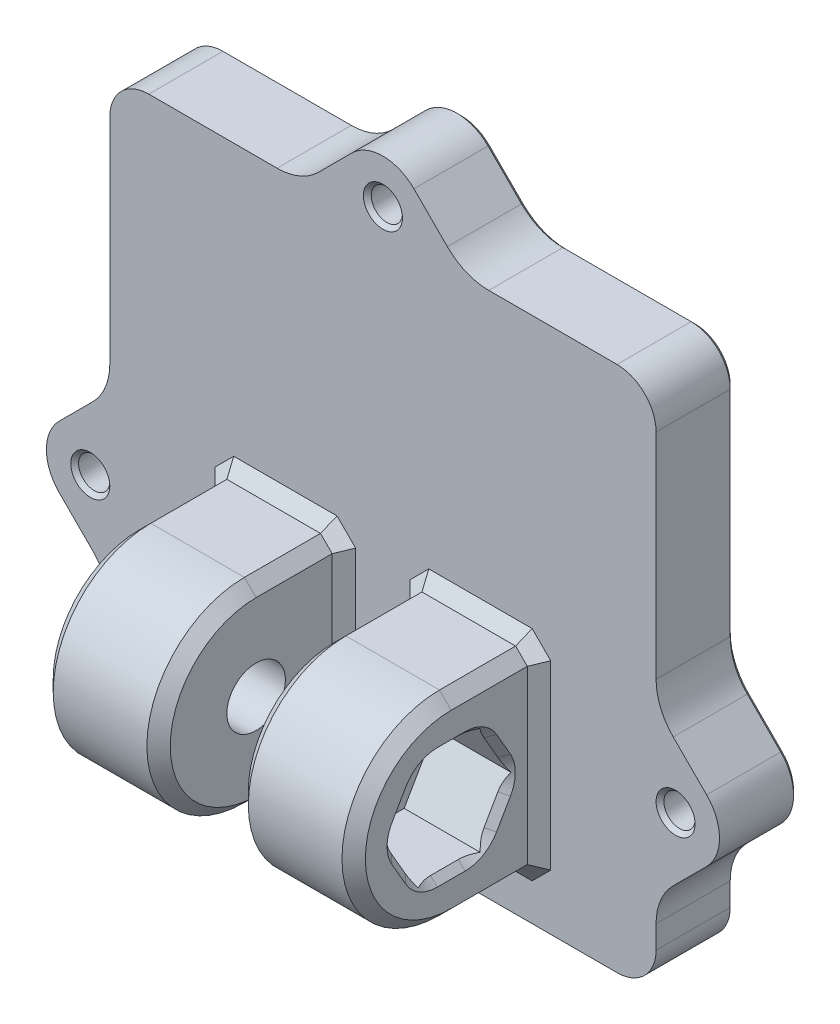
from build123d import *

# Parameters (mm, degrees)
SKETCH13_R          = 0.8
BOSS_EXTRUDE3_DEPTH = 4
BOSS_EXTRUDE4_START = -1
BOSS_EXTRUDE4_DEPTH = 1
SKETCH13_3_R        = 1.05
CUT_EXTRUDE10_DEPTH = 1
CHAMFER3_SIZE       = 0.6
CUT_EXTRUDE7_REACH  = 37.052
SKETCH15_W          = 22.3
SKETCH15_H          = 2.6
CUT_EXTRUDE8_DEPTH  = 0.4
CHAMFER4_SIZE       = 0.2
BOSS_EXTRUDE5_START = -14
BOSS_EXTRUDE5_DEPTH = 8
SKETCH18_W          = 4
SKETCH18_H          = 9.5
CUT_EXTRUDE11_DEPTH = 29.193527626
CUT_EXTRUDE13_START = -6
SKETCH17_3_R        = 2.75
SKETCH17_3_R_2      = 1.5
CUT_EXTRUDE13_DEPTH = 2.5
CUT_EXTRUDE14_START = -18
SKETCH17_4_R        = 2.75
SKETCH17_4_R_2      = 1.5
CUT_EXTRUDE14_DEPTH = 4
CUT_EXTRUDE16_START = -22
CUT_EXTRUDE16_DEPTH = 1
CUT_EXTRUDE16_TAPER = 45
CHAMFER5_SIZE       = 0.6
CHAMFER6_SIZE       = 0.6
SKETCH17_6_R        = 1.5
CUT_EXTRUDE17_DEPTH = 45.077346789
CHAMFER7_SIZE       = 0.4


with BuildPart() as part:
    # Sketch13 → Boss-Extrude3 (new body)
    with BuildSketch(Plane.XY):
        with BuildLine():
            Line((-5.424621202, -1), (-12, -1))
            ThreePointArc((-12, -1), (-13.414213562, -1.585786438), (-14, -3))
            Line((-14, -3), (-14, -13.975378798))
            ThreePointArc((-14, -13.975378798), (-14.228361402, -15.123429095), (-14.878679656, -16.096699141))
            Line((-14.878679656, -16.096699141), (-16.590990258, -17.809009742))
            ThreePointArc((-16.590990258, -17.809009742), (-17.25, -19.4), (-16.590990258, -20.990990258))
            Line((-16.590990258, -20.990990258), (-14.878679656, -22.703300859))
            ThreePointArc((-14.878679656, -22.703300859), (-14.228361402, -23.676570905), (-14, -24.824621202))
            Line((-14, -24.824621202), (-14, -26))
            ThreePointArc((-14, -26), (-13.414213562, -27.414213562), (-12, -28))
            Line((-12, -28), (12, -28))
            ThreePointArc((12, -28), (13.414213562, -27.414213562), (14, -26))
            Line((14, -26), (14, -24.824621202))
            ThreePointArc((14, -24.824621202), (14.228361402, -23.676570905), (14.878679656, -22.703300859))
            Line((14.878679656, -22.703300859), (16.590990258, -20.990990258))
            ThreePointArc((16.590990258, -20.990990258), (17.25, -19.4), (16.590990258, -17.809009742))
            Line((16.590990258, -17.809009742), (14.878679656, -16.096699141))
            ThreePointArc((14.878679656, -16.096699141), (14.228361402, -15.123429095), (14, -13.975378798))
            Line((14, -13.975378798), (14, -3))
            ThreePointArc((14, -3), (13.414213562, -1.585786438), (12, -1))
            Line((12, -1), (5.424621202, -1))
            ThreePointArc((5.424621202, -1), (4.276570905, -0.771638598), (3.303300859, -0.121320344))
            Line((3.303300859, -0.121320344), (1.590990258, 1.590990258))
            ThreePointArc((1.590990258, 1.590990258), (0, 2.25), (-1.590990258, 1.590990258))
            Line((-1.590990258, 1.590990258), (-3.303300859, -0.121320344))
            ThreePointArc((-3.303300859, -0.121320344), (-4.276570905, -0.771638598), (-5.424621202, -1))
        make_face()
        Circle(SKETCH13_R, mode=Mode.SUBTRACT)
        with Locations((15, -19.4)):
            Circle(SKETCH13_R, mode=Mode.SUBTRACT)
        with Locations((-15, -19.4)):
            Circle(SKETCH13_R, mode=Mode.SUBTRACT)
        with BuildLine():
            Line((7.35, -2.9), (-7.65, -2.9))
            ThreePointArc((-7.65, -2.9), (-8.357106781, -3.192893219), (-8.65, -3.9))
            Line((-8.65, -3.9), (-8.65, -4.575))
            ThreePointArc((-8.65, -4.575), (-9.235786438, -5.989213562), (-10.65, -6.575))
            Line((-10.65, -6.575), (-11.5, -6.575))
            ThreePointArc((-11.5, -6.575), (-12.207106781, -6.867893219), (-12.5, -7.575))
            Line((-12.5, -7.575), (-12.5, -14.075))
            ThreePointArc((-12.5, -14.075), (-12.207106781, -14.782106781), (-11.5, -15.075))
            Line((-11.5, -15.075), (-10.35, -15.075))
            ThreePointArc((-10.35, -15.075), (-8.35, -17.075), (-10.35, -19.075))
            Line((-10.35, -19.075), (-11.5, -19.075))
            ThreePointArc((-11.5, -19.075), (-12.207106781, -19.367893219), (-12.5, -20.075))
            Line((-12.5, -20.075), (-12.5, -24.5))
            ThreePointArc((-12.5, -24.5), (-11.914213562, -25.914213562), (-10.5, -26.5))
            Line((-10.5, -26.5), (10.5, -26.5))
            ThreePointArc((10.5, -26.5), (11.914213562, -25.914213562), (12.5, -24.5))
            Line((12.5, -24.5), (12.5, -20.075))
            ThreePointArc((12.5, -20.075), (12.207106781, -19.367893219), (11.5, -19.075))
            Line((11.5, -19.075), (10.15, -19.075))
            ThreePointArc((10.15, -19.075), (8.15, -17.075), (10.15, -15.075))
            Line((10.15, -15.075), (11.5, -15.075))
            ThreePointArc((11.5, -15.075), (12.207106781, -14.782106781), (12.5, -14.075))
            Line((12.5, -14.075), (12.5, -7.575))
            ThreePointArc((12.5, -7.575), (12.207106781, -6.867893219), (11.5, -6.575))
            Line((11.5, -6.575), (10.35, -6.575))
            ThreePointArc((10.35, -6.575), (8.935786438, -5.989213562), (8.35, -4.575))
            Line((8.35, -4.575), (8.35, -3.9))
            ThreePointArc((8.35, -3.9), (8.057106781, -3.192893219), (7.35, -2.9))
        make_face(mode=Mode.SUBTRACT)
    extrude(amount=BOSS_EXTRUDE3_DEPTH)

    # Sketch14 → Boss-Extrude4 (add)
    with BuildSketch(Plane.XY.offset(4).offset(BOSS_EXTRUDE4_START)):
        with BuildLine():
            Line((12, -1), (0.320156212, -1))
            ThreePointArc((0.320156212, -1), (0, -1.05), (-0.320156212, -1))
            Line((-0.320156212, -1), (-12, -1))
            ThreePointArc((-12, -1), (-13.414213562, -1.585786438), (-14, -3))
            Line((-14, -3), (-14, -19.079843788))
            ThreePointArc((-14, -19.079843788), (-13.95, -19.4), (-14, -19.720156212))
            Line((-14, -19.720156212), (-14, -26))
            ThreePointArc((-14, -26), (-13.414213562, -27.414213562), (-12, -28))
            Line((-12, -28), (12, -28))
            ThreePointArc((12, -28), (13.414213562, -27.414213562), (14, -26))
            Line((14, -26), (14, -19.720156212))
            ThreePointArc((14, -19.720156212), (13.95, -19.4), (14, -19.079843788))
            Line((14, -19.079843788), (14, -3))
            ThreePointArc((14, -3), (13.414213562, -1.585786438), (12, -1))
        make_face()
    extrude(amount=BOSS_EXTRUDE4_DEPTH)

    # Sketch13<3> → Cut-Extrude10 (cut)
    with BuildSketch(Plane.XY):
        with Locations((10.35, -4.575)):
            Circle(SKETCH13_3_R)
        with Locations((-10.65, -4.575)):
            Circle(SKETCH13_3_R)
        with Locations((-10.35, -17.075)):
            Circle(SKETCH13_3_R)
        with Locations((10.15, -17.075)):
            Circle(SKETCH13_3_R)
    extrude(amount=CUT_EXTRUDE10_DEPTH, mode=Mode.SUBTRACT)

    # Chamfer3
    chamfer3_edges = [part.edges().sort_by_distance(p)[0] for p in [
        (-9.235786438, -5.989213562, 3),
        (-8.357106781, -3.192893219, 3),
        (8.35, -4.2375, 3),
        (0, -26.5, 3),
        (-11.914213562, -25.914213562, 3),
        (-12.5, -22.2875, 3),
        (-12.207106781, -19.367893219, 3),
        (-10.925, -19.075, 3),
        (-8.35, -17.075, 3),
        (-10.925, -15.075, 3),
        (-12.207106781, -14.782106781, 3),
        (-12.5, -10.825, 3),
        (-12.207106781, -6.867893219, 3),
        (-11.075, -6.575, 3),
        (-8.65, -4.2375, 3),
        (11.914213562, -25.914213562, 3),
        (12.5, -22.2875, 3),
        (12.207106781, -19.367893219, 3),
        (10.825, -19.075, 3),
        (8.15, -17.075, 3),
        (10.825, -15.075, 3),
        (12.207106781, -14.782106781, 3),
        (12.5, -10.825, 3),
        (12.207106781, -6.867893219, 3),
        (10.925, -6.575, 3),
        (8.935786438, -5.989213562, 3),
        (8.057106781, -3.192893219, 3),
        (-0.15, -2.9, 3),
    ]]
    chamfer(chamfer3_edges, length=CHAMFER3_SIZE)

    # Sketch15 → Cut-Extrude7 (cut, up to next)
    with BuildSketch(Plane.XZ.offset(28), mode=Mode.PRIVATE) as cut_extrude7_sk1:
        with Locations((0, 1.3)):
            Rectangle(SKETCH15_W, SKETCH15_H)
    cut_extrude7_tool1 = extrude(cut_extrude7_sk1.sketch, amount=-CUT_EXTRUDE7_REACH, mode=Mode.PRIVATE) & part.part
    add(cut_extrude7_tool1.solids().sort_by_distance((0, -28, 1.3))[0], mode=Mode.SUBTRACT)

    # Sketch16 → Cut-Extrude8 (cut)
    with BuildSketch(Plane(origin=(0, 0, 2.6), x_dir=(-1, 0, 0), z_dir=(0, 0, -1))):
        with BuildLine():
            Line((10.5, -26.3), (-10.5, -26.3))
            ThreePointArc((-10.5, -26.3), (-10.830625272, -26.269374728), (-11.15, -26.178541033))
            Line((-11.15, -26.178541033), (-11.15, -25.739959677))
            ThreePointArc((-11.15, -25.739959677), (-10.834706179, -25.859401256), (-10.5, -25.9))
            Line((-10.5, -25.9), (10.5, -25.9))
            ThreePointArc((10.5, -25.9), (10.834706179, -25.859401256), (11.15, -25.739959677))
            Line((11.15, -25.739959677), (11.15, -26.178541033))
            ThreePointArc((11.15, -26.178541033), (10.830625272, -26.269374728), (10.5, -26.3))
        make_face()
    extrude(amount=-CUT_EXTRUDE8_DEPTH, mode=Mode.SUBTRACT)

    # Chamfer4
    chamfer4_edges = [part.edges().sort_by_distance(p)[0] for p in [
        (14.2, -19.4, 4),
        (-0.8, 0, 4),
        (-15.8, -19.4, 4),
        (9.3, -4.575, 0),
        (-11.7, -4.575, 0),
        (-11.4, -17.075, 0),
        (9.1, -17.075, 0),
        (-12.12788206, -25.661895004, 0),
        (12.12788206, -25.661895004, 0),
        (-11.575, -28, 0),
        (17.25, -19.4, 0),
        (15.734834957, -21.847145558, 0),
        (14.228361402, -23.676570905, 0),
        (14, -25.412310601, 0),
        (13.414213562, -27.414213562, 0),
        (11.575, -28, 0),
        (-13.414213562, -27.414213562, 0),
        (-14, -25.412310601, 0),
        (-14.228361402, -23.676570905, 0),
        (-15.734834957, -21.847145558, 0),
        (-17.25, -19.4, 0),
        (-15.734834957, -16.952854442, 0),
        (-14.228361402, -15.123429095, 0),
        (-14, -8.487689399, 0),
        (-13.414213562, -1.585786438, 0),
        (-8.712310601, -1, 0),
        (-4.276570905, -0.771638598, 0),
        (-2.447145558, 0.734834957, 0),
        (0, 2.25, 0),
        (2.447145558, 0.734834957, 0),
        (4.276570905, -0.771638598, 0),
        (8.712310601, -1, 0),
        (13.414213562, -1.585786438, 0),
        (14, -8.487689399, 0),
        (14.228361402, -15.123429095, 0),
        (15.734834957, -16.952854442, 0),
        (-15.8, -19.4, 0),
        (-0.8, 0, 0),
        (14.2, -19.4, 0),
        (-9.235786438, -5.989213562, 0),
        (-11.075, -6.575, 0),
        (-12.207106781, -6.867893219, 0),
        (-12.5, -10.825, 0),
        (-12.207106781, -14.782106781, 0),
        (-10.925, -15.075, 0),
        (-8.35, -17.075, 0),
        (-10.925, -19.075, 0),
        (-12.207106781, -19.367893219, 0),
        (-12.5, -22.2875, 0),
        (12.5, -22.2875, 0),
        (12.207106781, -19.367893219, 0),
        (10.825, -19.075, 0),
        (8.15, -17.075, 0),
        (10.825, -15.075, 0),
        (12.207106781, -14.782106781, 0),
        (12.5, -10.825, 0),
        (12.207106781, -6.867893219, 0),
        (10.925, -6.575, 0),
        (8.935786438, -5.989213562, 0),
        (8.35, -4.2375, 0),
        (8.057106781, -3.192893219, 0),
        (-0.15, -2.9, 0),
        (-8.357106781, -3.192893219, 0),
        (-8.65, -4.2375, 0),
    ]]
    chamfer(chamfer4_edges, length=CHAMFER4_SIZE)

    # Sketch17 → Boss-Extrude5 (add, symmetric)
    with BuildSketch(Plane.ZY.offset(14).offset(BOSS_EXTRUDE5_START)):
        with BuildLine():
            Line((4, -15.5), (8.5, -15.5))
            ThreePointArc((8.5, -15.5), (13.5, -20.5), (8.5, -25.5))
            Line((8.5, -25.5), (4, -25.5))
            Line((4, -25.5), (4, -15.5))
        make_face()
    extrude(amount=BOSS_EXTRUDE5_DEPTH, both=True)

    # Sketch18 → Cut-Extrude11 (cut, through all)
    with BuildSketch(Plane(origin=(0, -15.5, 0), x_dir=(1, 0, 0), z_dir=(0, 1, 0))):
        with Locations((0, -8.75)):
            Rectangle(SKETCH18_W, SKETCH18_H)
    extrude(amount=-CUT_EXTRUDE11_DEPTH, mode=Mode.SUBTRACT)

    # Sketch17<3> → Cut-Extrude13 (cut)
    # profile 1 of 2: a face of its own
    with BuildSketch(Plane.ZY.offset(14).offset(CUT_EXTRUDE13_START)):
        with Locations((8.5, -20.5)):
            Circle(SKETCH17_3_R)
        with Locations((8.5, -20.5)):
            Circle(SKETCH17_3_R_2, mode=Mode.SUBTRACT)
    # profile 2 of 2: a face of its own
    with BuildSketch(Plane.ZY.offset(14).offset(CUT_EXTRUDE13_START)):
        with Locations((8.5, -20.5)):
            Circle(SKETCH17_3_R_2)
    extrude(amount=-CUT_EXTRUDE13_DEPTH, mode=Mode.SUBTRACT)

    # Sketch17<4> → Cut-Extrude14 (cut)
    # profile 1 of 8: a face of its own
    with BuildSketch(Plane.ZY.offset(14).offset(CUT_EXTRUDE14_START)):
        Polygon((6.91228676, -23.25), (10.08771324, -23.25), (11.675426481, -20.5), (10.08771324, -17.75), (6.91228676, -17.75), (5.324573519, -20.5), align=None)
        with Locations((8.5, -20.5)):
            Circle(SKETCH17_4_R, mode=Mode.SUBTRACT)
    # profile 2 of 8: a face of its own
    with BuildSketch(Plane.ZY.offset(14).offset(CUT_EXTRUDE14_START)):
        with Locations((8.5, -20.5)):
            Circle(SKETCH17_4_R)
        with Locations((8.5, -20.5)):
            Circle(SKETCH17_4_R_2, mode=Mode.SUBTRACT)
    # profile 3 of 8: a face of its own
    with BuildSketch(Plane.ZY.offset(14).offset(CUT_EXTRUDE14_START)):
        with Locations((8.5, -20.5)):
            Circle(SKETCH17_4_R_2)
    # profile 4 of 8: a face of its own
    with BuildSketch(Plane.ZY.offset(14).offset(CUT_EXTRUDE14_START)):
        with BuildLine():
            Line((10.881569851, -21.875000017), (11.675426481, -20.5))
            Line((11.675426481, -20.5), (10.881569873, -19.125000022))
            ThreePointArc((10.881569873, -19.125000022), (11.156296026, -19.788247638), (11.25, -20.5))
            ThreePointArc((11.25, -20.5), (11.15629602, -21.211752383), (10.881569851, -21.875000017))
        make_face()
    # profile 5 of 8: a face of its own
    with BuildSketch(Plane.ZY.offset(14).offset(CUT_EXTRUDE14_START)):
        with BuildLine():
            Line((10.08771324, -23.25), (10.881569851, -21.875000017))
            ThreePointArc((10.881569851, -21.875000017), (9.874999992, -22.881569865), (8.5, -23.25))
            Line((8.5, -23.25), (10.08771324, -23.25))
        make_face()
    # profile 6 of 8: a face of its own
    with BuildSketch(Plane.ZY.offset(14).offset(CUT_EXTRUDE14_START)):
        with BuildLine():
            ThreePointArc((6.118430137, -21.874999995), (5.75, -20.499999988), (6.118430149, -19.124999983))
            Line((6.118430149, -19.124999983), (5.324573519, -20.5))
            Line((5.324573519, -20.5), (6.118430137, -21.874999995))
        make_face()
    # profile 7 of 8: a face of its own
    with BuildSketch(Plane.ZY.offset(14).offset(CUT_EXTRUDE14_START)):
        with BuildLine():
            ThreePointArc((6.118430149, -19.124999983), (7.125000008, -18.118430135), (8.5, -17.75))
            Line((8.5, -17.75), (6.91228676, -17.75))
            Line((6.91228676, -17.75), (6.118430149, -19.124999983))
        make_face()
    # profile 8 of 8: a face of its own
    with BuildSketch(Plane.ZY.offset(14).offset(CUT_EXTRUDE14_START)):
        with BuildLine():
            Line((6.91228676, -23.25), (8.5, -23.25))
            ThreePointArc((8.5, -23.25), (7.124999998, -22.881569859), (6.118430137, -21.874999995))
            Line((6.118430137, -21.874999995), (6.91228676, -23.25))
        make_face()
    extrude(amount=-CUT_EXTRUDE14_DEPTH, mode=Mode.SUBTRACT)

    # Sketch17<5> → Cut-Extrude16 (cut)
    with BuildSketch(Plane.ZY.offset(14).offset(CUT_EXTRUDE16_START)):
        with BuildLine():
            Line((11.535998996, -19.569385457), (10.823935333, -18.336055015))
            ThreePointArc((10.823935333, -18.336055015), (10.142678206, -17.654797887), (9.212063663, -17.405440472))
            Line((9.212063663, -17.405440472), (7.787936337, -17.405440472))
            ThreePointArc((7.787936337, -17.405440472), (6.857321794, -17.654797887), (6.176064667, -18.336055015))
            Line((6.176064667, -18.336055015), (5.464001004, -19.569385457))
            ThreePointArc((5.464001004, -19.569385457), (5.214643588, -20.5), (5.464001004, -21.430614543))
            Line((5.464001004, -21.430614543), (6.176064667, -22.663944985))
            ThreePointArc((6.176064667, -22.663944985), (6.857321794, -23.345202113), (7.787936337, -23.594559528))
            Line((7.787936337, -23.594559528), (9.212063663, -23.594559528))
            ThreePointArc((9.212063663, -23.594559528), (10.142678206, -23.345202113), (10.823935333, -22.663944985))
            Line((10.823935333, -22.663944985), (11.535998996, -21.430614543))
            ThreePointArc((11.535998996, -21.430614543), (11.785356412, -20.5), (11.535998996, -19.569385457))
        make_face()
    extrude(amount=CUT_EXTRUDE16_DEPTH, taper=CUT_EXTRUDE16_TAPER, mode=Mode.SUBTRACT)

    # Chamfer5
    chamfer5_edges = [part.edges().sort_by_distance(p)[0] for p in [
        (-8, -15.5, 6.25),
        (-8, -25.5, 6.25),
        (-8, -20.5, 13.5),
        (8, -15.5, 6.25),
        (8, -20.5, 13.5),
        (8, -25.5, 6.25),
        (2, -20.5, 13.5),
        (-2, -20.5, 13.5),
        (-2, -25.5, 6.25),
        (2, -25.5, 6.25),
        (2, -15.5, 6.25),
        (-2, -15.5, 6.25),
    ]]
    chamfer(chamfer5_edges, length=CHAMFER5_SIZE)

    # Chamfer6
    chamfer6_edges = [part.edges().sort_by_distance(p)[0] for p in [
        (-5, -15.5, 4),
        (-8, -20.5, 4),
        (-5, -25.5, 4),
        (-2, -20.5, 4),
        (2, -20.5, 4),
        (5, -25.5, 4),
        (5, -15.5, 4),
        (8, -20.5, 4),
        (-7.7, -15.8, 4),
        (-7.7, -25.2, 4),
        (-2.3, -15.8, 4),
        (-2.3, -25.2, 4),
        (2.3, -25.2, 4),
        (2.3, -15.8, 4),
        (7.7, -25.2, 4),
        (7.7, -15.8, 4),
    ]]
    chamfer(chamfer6_edges, length=CHAMFER6_SIZE)

    # Sketch17<6> → Cut-Extrude17 (cut, through all)
    with BuildSketch(Plane.ZY.offset(14)):
        with Locations((8.5, -20.5)):
            Circle(SKETCH17_6_R)
    extrude(amount=-CUT_EXTRUDE17_DEPTH, mode=Mode.SUBTRACT)

    # Chamfer7
    chamfer7_edges = [part.edges().sort_by_distance(p)[0] for p in [
        (-8, -20.5, 5.75),
    ]]
    chamfer(chamfer7_edges, length=CHAMFER7_SIZE)


solid = part.part
